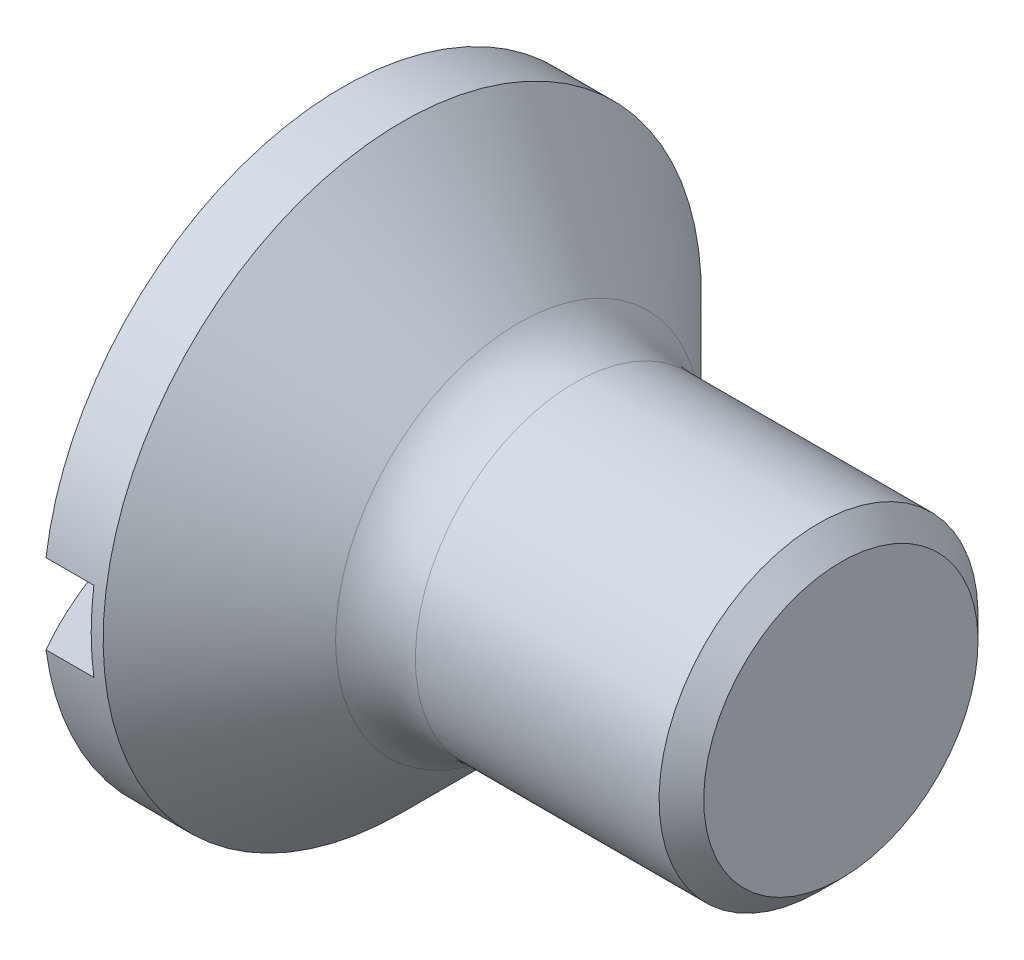
from build123d import *

# Parameters (mm, degrees)
SKICA2_W                 = 3
SKICA2_H                 = 0.4
ODEBRAT_VYSUNUT_M1_DEPTH = 4.099612879
ZAOBLIT1_R               = 0.4
ZKOSIT1_SIZE             = 0.112


with BuildPart() as part:
    # Skica1 → Otočit kolem osy1 (revolve)
    with BuildSketch(Plane.XY, mode=Mode.PRIVATE) as oto_it_kolem_osy1_sk:
        with BuildLine():
            Line((0.4, 1.5), (0.7, 1.5))
            Line((0.7, 1.5), (1.4, 0.8))
            Line((1.4, 0.8), (2.9, 0.8))
            Line((2.9, 0.8), (2.9, 0))
            Line((2.9, 0), (0, 0))
            ThreePointArc((0, 0), (0.101717244, 0.776208735), (0.4, 1.5))
        make_face()
    revolve(oto_it_kolem_osy1_sk.sketch.rotate(Axis((0, 0, 0), (1, 0, 0)), 180), axis=Axis((0, 0, 0), (1, 0, 0)))

    # Skica2 → Odebrat vysunutím1 (cut, through all)
    with BuildSketch(Plane(origin=(0.64, 0, 0), x_dir=(0, 0, -1), z_dir=(1, 0, 0))):
        Rectangle(SKICA2_W, SKICA2_H)
    extrude(amount=-ODEBRAT_VYSUNUT_M1_DEPTH, mode=Mode.SUBTRACT)

    # Zaoblit1
    zaoblit1_edges = [part.edges().sort_by_distance(p)[0] for p in [
        (1.4, 0.8, 0),
    ]]
    fillet(zaoblit1_edges, radius=ZAOBLIT1_R)

    # Zkosit1
    zkosit1_edges = [part.edges().sort_by_distance(p)[0] for p in [
        (2.9, 0.8, 0),
    ]]
    chamfer(zkosit1_edges, length=ZKOSIT1_SIZE)


solid = part.part
